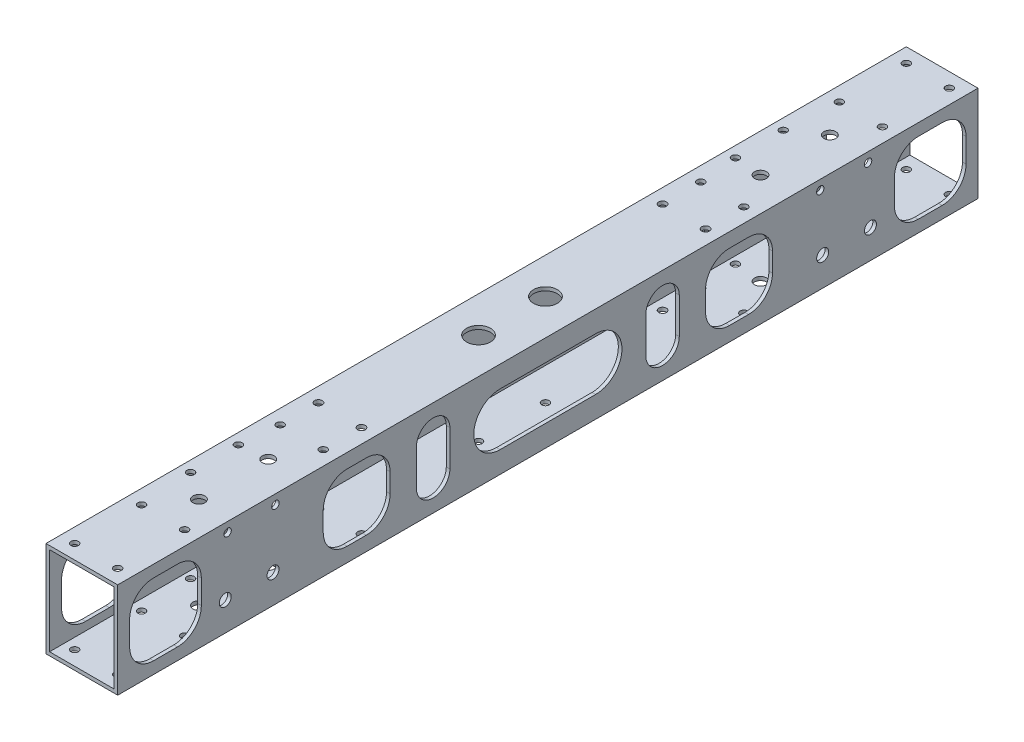
from build123d import *

# Parameters (mm, degrees)
SKETCH_1_W           = 30
SKETCH_1_H           = 40
SKETCH_1_W_2         = 27
SKETCH_1_H_2         = 37
EXTRUDE_1_DEPTH      = 180
SKETCH_2_R           = 1.55
CUT_EXTRUDE_1_DEPTH  = 10
SKETCH_3_R           = 1.6
CUT_EXTRUDE_2_DEPTH  = 40
CUT_EXTRUDE_3_DEPTH  = 10
SKETCH_5_R           = 5
CUT_EXTRUDE_4_DEPTH  = 10
SKETCH_6_W           = 30
SKETCH_6_H           = 30
CUT_EXTRUDE_5_DEPTH  = 30
FILLET_1_R           = 10
SKETCH_8_R           = 1.55
CUT_EXTRUDE_6_DEPTH  = 40
SKETCH_9_R           = 2.5
CUT_EXTRUDE_7_DEPTH  = 40
SKETCH_10_R          = 2.5
CUT_EXTRUDE_8_DEPTH  = 40
SKETCH_11_R          = 2.5
CUT_EXTRUDE_9_DEPTH  = 40
SKETCH_12_R          = 1.55
CUT_EXTRUDE_10_DEPTH = 40
SKETCH_14_R          = 1.55
CUT_EXTRUDE_11_DEPTH = 50
CUT_EXTRUDE_12_DEPTH = 40


with BuildPart() as part:
    # 草图1 → 凸台-拉伸1 (new, symmetric)
    with BuildSketch(Plane.XY):
        Rectangle(SKETCH_1_W, SKETCH_1_H)
        Rectangle(SKETCH_1_W_2, SKETCH_1_H_2, mode=Mode.SUBTRACT)
    extrude(amount=EXTRUDE_1_DEPTH, both=True)

    # 草图2 → 切除-拉伸1 (cut)
    with BuildSketch(Plane.XZ.offset(20)):
        with Locations(Location((0, 14, 0), (0, 0, 270))):
            Circle(SKETCH_2_R)
        with Locations(Location((0, -14, 0), (0, 0, 270))):
            Circle(SKETCH_2_R)
    extrude(amount=-CUT_EXTRUDE_1_DEPTH, mode=Mode.SUBTRACT)

    # 草图3 → 切除-拉伸2 (cut)
    with BuildSketch(Plane.XZ.offset(20)):
        with Locations(Location((-8.99, 72, 0), (0, 0, 270))):
            Circle(SKETCH_3_R)
        with Locations(Location((9.01, 72, 0), (0, 0, 270))):
            Circle(SKETCH_3_R)
        with Locations(Location((-8.99, -72, 0), (0, 0, 270))):
            Circle(SKETCH_3_R)
        with Locations(Location((9.01, -72, 0), (0, 0, 270))):
            Circle(SKETCH_3_R)
    extrude(amount=-CUT_EXTRUDE_2_DEPTH, mode=Mode.SUBTRACT)

    # 草图4 → 切除-拉伸3 (cut)
    with BuildSketch(Plane(origin=(15, 0, 0), x_dir=(0, 0, -1), z_dir=(1, 0, 0))):
        with BuildLine():
            Line((-20, 11), (20, 11))
            ThreePointArc((20, 11), (31, 0), (20, -11))
            Line((20, -11), (-20, -11))
            ThreePointArc((-20, -11), (-31, 0), (-20, 11))
        make_face()
    extrude(amount=-CUT_EXTRUDE_3_DEPTH, mode=Mode.SUBTRACT)

    # 草图5 → 切除-拉伸4 (cut)
    with BuildSketch(Plane.XZ.offset(-18.5)):
        with Locations(Location((0, 14, 0), (0, 0, 270))):
            Circle(SKETCH_5_R)
        with Locations(Location((0, -14, 0), (0, 0, 270))):
            Circle(SKETCH_5_R)
    extrude(amount=-CUT_EXTRUDE_4_DEPTH, mode=Mode.SUBTRACT)

    # 草图6 → 切除-拉伸5 (cut)
    with BuildSketch(Plane.ZY.offset(15)):
        with Locations((160, 0)):
            Rectangle(SKETCH_6_W, SKETCH_6_H)
        with Locations((-160, 0)):
            Rectangle(SKETCH_6_W, SKETCH_6_H)
    extrude(amount=-CUT_EXTRUDE_5_DEPTH, mode=Mode.SUBTRACT)

    # 圆角1
    fillet_1_edges = [part.edges().sort_by_distance(p)[0] for p in [
        (14.25, 15, 175),
        (14.25, -15, 175),
        (14.25, -15, 145),
        (14.25, 15, 145),
        (-14.25, 15, 175),
        (-14.25, -15, 175),
        (-14.25, -15, 145),
        (-14.25, 15, 145),
        (14.25, 15, -145),
        (14.25, -15, -145),
        (14.25, -15, -175),
        (14.25, 15, -175),
        (-14.25, 15, -145),
        (-14.25, -15, -145),
        (-14.25, -15, -175),
        (-14.25, 15, -175),
    ]]
    fillet(fillet_1_edges, radius=FILLET_1_R)

    # 草图8 → 切除-拉伸6 (cut)
    with BuildSketch(Plane.XZ.offset(20)):
        with Locations(Location((-9, 88, 0), (0, 0, 270))):
            Circle(SKETCH_8_R)
        with Locations(Location((9, 88, 0), (0, 0, 270))):
            Circle(SKETCH_8_R)
        with Locations(Location((-9, -88, 0), (0, 0, 270))):
            Circle(SKETCH_8_R)
        with Locations(Location((9, -88, 0), (0, 0, 270))):
            Circle(SKETCH_8_R)
        with Locations(Location((-9, -146, 0), (0, 0, 270))):
            Circle(SKETCH_8_R)
        with Locations(Location((9, -146, 0), (0, 0, 270))):
            Circle(SKETCH_8_R)
        with Locations(Location((-9, -174, 0), (0, 0, 270))):
            Circle(SKETCH_8_R)
        with Locations(Location((9, -174, 0), (0, 0, 270))):
            Circle(SKETCH_8_R)
        with Locations(Location((9, 174, 0), (0, 0, 90))):
            Circle(SKETCH_8_R)
        with Locations(Location((-9, 174, 0), (0, 0, 90))):
            Circle(SKETCH_8_R)
        with Locations(Location((9, 146, 0), (0, 0, 90))):
            Circle(SKETCH_8_R)
        with Locations(Location((-9, 146, 0), (0, 0, 90))):
            Circle(SKETCH_8_R)
    extrude(amount=-CUT_EXTRUDE_6_DEPTH, mode=Mode.SUBTRACT)

    # 草图9 → 切除-拉伸7 (cut)
    with BuildSketch(Plane(origin=(0, 20, 0), x_dir=(1, 0, 0), z_dir=(0, 1, 0))):
        with Locations(Location((1, -103, 0), (0, 0, 270))):
            Circle(SKETCH_9_R)
        with Locations(Location((1, -132, 0), (0, 0, 270))):
            Circle(SKETCH_9_R)
    extrude(amount=-CUT_EXTRUDE_7_DEPTH, mode=Mode.SUBTRACT)

    # 草图10 → 切除-拉伸8 (cut)
    with BuildSketch(Plane(origin=(0, 20, 0), x_dir=(1, 0, 0), z_dir=(0, 1, 0))):
        with Locations(Location((1, 103, 0), (0, 0, 270))):
            Circle(SKETCH_10_R)
        with Locations(Location((1, 132, 0), (0, 0, 270))):
            Circle(SKETCH_10_R)
    extrude(amount=-CUT_EXTRUDE_8_DEPTH, mode=Mode.SUBTRACT)

    # 草图11 → 切除-拉伸9 (cut)
    with BuildSketch(Plane.ZY.offset(15)):
        with Locations(Location((115, -8, 0), (0, 0, 270))):
            Circle(SKETCH_11_R)
        with Locations(Location((135, -8, 0), (0, 0, 270))):
            Circle(SKETCH_11_R)
        with Locations(Location((-135, -8, 0), (0, 0, 180))):
            Circle(SKETCH_11_R)
        with Locations(Location((-115, -8, 0), (0, 0, 180))):
            Circle(SKETCH_11_R)
        with BuildLine():
            Line((76, 14), (84, 14))
            ThreePointArc((84, 14), (91.071067812, 11.071067812), (94, 4))
            Line((94, 4), (94, -4))
            ThreePointArc((94, -4), (91.071067812, -11.071067812), (84, -14))
            Line((84, -14), (76, -14))
            ThreePointArc((76, -14), (68.928932188, -11.071067812), (66, -4))
            Line((66, -4), (66, 4))
            ThreePointArc((66, 4), (68.928932188, 11.071067812), (76, 14))
        make_face()
        with BuildLine():
            Line((-94, 4), (-94, -4))
            ThreePointArc((-94, -4), (-91.071067812, -11.071067812), (-84, -14))
            Line((-84, -14), (-76, -14))
            ThreePointArc((-76, -14), (-68.928932188, -11.071067812), (-66, -4))
            Line((-66, -4), (-66, 4))
            ThreePointArc((-66, 4), (-68.928932188, 11.071067812), (-76, 14))
            Line((-76, 14), (-84, 14))
            ThreePointArc((-84, 14), (-91.071067812, 11.071067812), (-94, 4))
        make_face()
    extrude(amount=-CUT_EXTRUDE_9_DEPTH, mode=Mode.SUBTRACT)

    # 草图12 → 切除-拉伸10 (cut)
    with BuildSketch(Plane.ZY.offset(15)):
        with Locations(Location((114, 16, 0), (0, 0, 270))):
            Circle(SKETCH_12_R)
        with Locations(Location((134, 16, 0), (0, 0, 270))):
            Circle(SKETCH_12_R)
        with Locations(Location((-134, 16, 0), (0, 0, 270))):
            Circle(SKETCH_12_R)
        with Locations(Location((-114, 16, 0), (0, 0, 270))):
            Circle(SKETCH_12_R)
    extrude(amount=-CUT_EXTRUDE_10_DEPTH, mode=Mode.SUBTRACT)

    # 草图14 → 切除-拉伸11 (cut)
    with BuildSketch(Plane(origin=(0, 20, 0), x_dir=(1, 0, 0), z_dir=(0, 1, 0))):
        with Locations(Location((-10.5, -124, 0), (0, 0, 270))):
            Circle(SKETCH_14_R)
        with Locations(Location((-10.5, -104, 0), (0, 0, 270))):
            Circle(SKETCH_14_R)
        with Locations(Location((-10.5, 104, 0), (0, 0, 270))):
            Circle(SKETCH_14_R)
        with Locations(Location((-10.5, 124, 0), (0, 0, 270))):
            Circle(SKETCH_14_R)
    extrude(amount=-CUT_EXTRUDE_11_DEPTH, mode=Mode.SUBTRACT)

    # 草图15 → 切除-拉伸12 (cut)
    with BuildSketch(Plane(origin=(15, 0, 0), x_dir=(0, 0, -1), z_dir=(1, 0, 0))):
        with BuildLine():
            Line((55, 7.5), (55, -7.5))
            ThreePointArc((55, -7.5), (48, -14.5), (41, -7.5))
            Line((41, -7.5), (41, 7.5))
            ThreePointArc((41, 7.5), (48, 14.5), (55, 7.5))
        make_face()
        with BuildLine():
            Line((-55, 7.5), (-55, -7.5))
            ThreePointArc((-55, -7.5), (-48, -14.5), (-41, -7.5))
            Line((-41, -7.5), (-41, 7.5))
            ThreePointArc((-41, 7.5), (-48, 14.5), (-55, 7.5))
        make_face()
    extrude(amount=-CUT_EXTRUDE_12_DEPTH, mode=Mode.SUBTRACT)


solid = part.part
